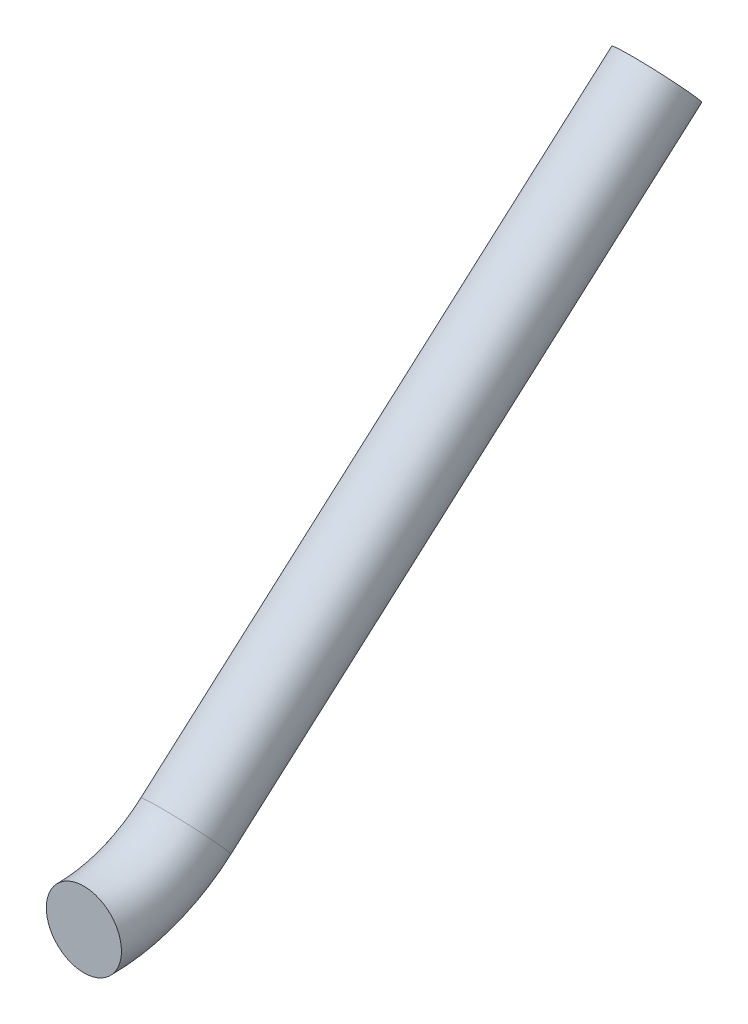
from build123d import *

# Parameters (mm, degrees)
SKETCH2_R = 85.725


with BuildPart() as part:
    # Sweep1: sweep along a path in Sketch1
    with BuildLine(Plane(origin=(0, 0, 0), x_dir=(0, 0, -1), z_dir=(1, 0, 0))) as sweep1_path:
        Line((0, 0), (-1074.487503675, -948.457873533))
        ThreePointArc((-1074.487503675, -948.457873533), (-1182.668936297, -1013.656087924), (-1306.919498271, -1036.367921258))
    # Sketch2 → Sweep1 (sweep)
    with BuildSketch(Plane(origin=(0, 0, 0), x_dir=(-1, 0, 0), z_dir=(0, 0.6617709607020787, -0.7497060727854936))):
        Circle(SKETCH2_R)
    sweep(path=sweep1_path.line)


solid = part.part
